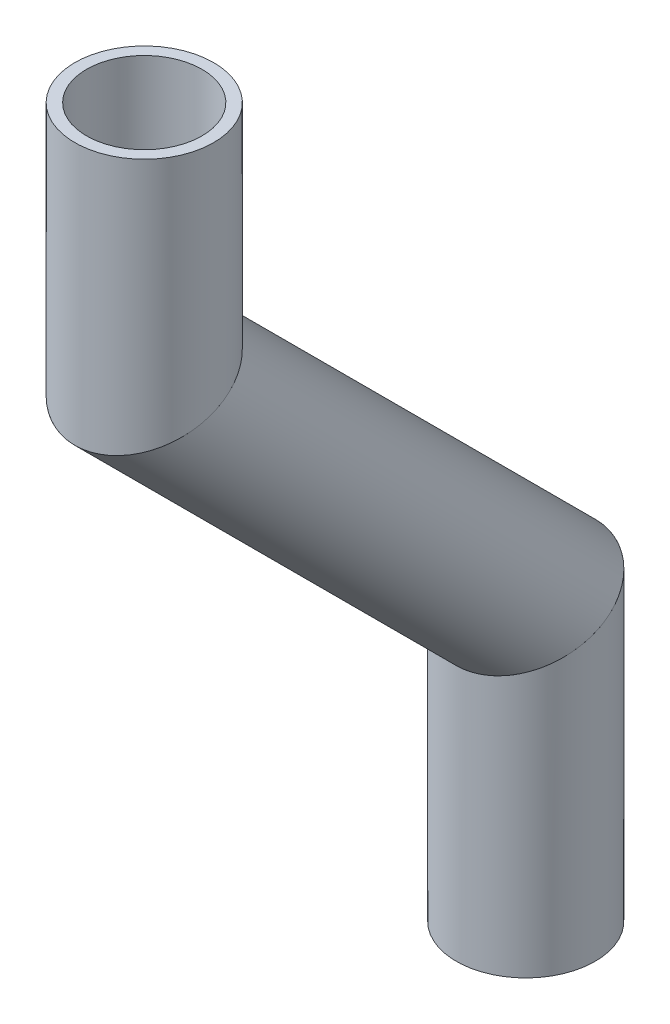
from build123d import *

# Parameters (mm, degrees)
SKETCH11_R                = 6.35
SKETCH11_R_2              = 5.2832
PIPE_0_5_SCH_40_1_DEPTH   = 26.080611598
SKETCH11_ON_SEGMENT_2_R   = 6.35
SKETCH11_ON_SEGMENT_2_R_2 = 5.2832
PIPE_0_5_SCH_40_1_2_DEPTH = 58.810656537
SKETCH11_ON_SEGMENT_3_R   = 6.35
SKETCH11_ON_SEGMENT_3_R_2 = 5.2832
PIPE_0_5_SCH_40_1_3_DEPTH = 30.788829985


with BuildPart() as part:
    # Sketch11 → Pipe 0.5 SCH 40(1) (new body)
    with BuildSketch(Plane(origin=(0, -435.341064838, 362.765281468), x_dir=(0, 0, -1), z_dir=(0, -1, 0))):
        Circle(SKETCH11_R)
        Circle(SKETCH11_R_2, mode=Mode.SUBTRACT)
    extrude(amount=PIPE_0_5_SCH_40_1_DEPTH)

    # Pipe 0.5 SCH 40(1) mitre 1
    split(bisect_by=Plane(origin=(0, -456.701932557, 362.765281468), x_dir=(-1, 0, 0), z_dir=(0, 0.923879533, 0.382683432)), keep=Keep.TOP)


with BuildPart() as body_2:
    # Sketch11 on segment 2 (carried to segment 2) → Pipe 0.5 SCH 40_1 2 (new body)
    with BuildSketch(Plane(origin=(0, -453.364569654, 366.10264437), x_dir=(0, 0.707106781, -0.707106781), z_dir=(0, -0.707106781, -0.707106781))):
        Circle(SKETCH11_ON_SEGMENT_2_R)
        Circle(SKETCH11_ON_SEGMENT_2_R_2, mode=Mode.SUBTRACT)
    extrude(amount=PIPE_0_5_SCH_40_1_2_DEPTH)

    # Pipe 0.5 SCH 40_1 2 mitre 1
    split(bisect_by=Plane(origin=(0, -456.701932557, 362.765281468), x_dir=(1, 0, 0), z_dir=(0, -0.923879533, -0.382683432)), keep=Keep.TOP)

    # Pipe 0.5 SCH 40_1 2 mitre 2
    split(bisect_by=Plane(origin=(0, -491.612620796, 327.854593229), x_dir=(-1, 0, 0), z_dir=(0, 0.923879533, 0.382683432)), keep=Keep.TOP)


with BuildPart() as body_3:
    # Sketch11 on segment 3 (carried to segment 3) → Pipe 0.5 SCH 40_1 3 (new body)
    with BuildSketch(Plane(origin=(0, -486.892876917, 327.854593229), x_dir=(0, 0, -1), z_dir=(0, -1, 0))):
        Circle(SKETCH11_ON_SEGMENT_3_R)
        Circle(SKETCH11_ON_SEGMENT_3_R_2, mode=Mode.SUBTRACT)
    extrude(amount=PIPE_0_5_SCH_40_1_3_DEPTH)

    # Pipe 0.5 SCH 40_1 3 mitre 1
    split(bisect_by=Plane(origin=(0, -491.612620796, 327.854593229), x_dir=(1, 0, 0), z_dir=(0, -0.923879533, -0.382683432)), keep=Keep.TOP)


solid = Compound([part.part, body_2.part, body_3.part])
